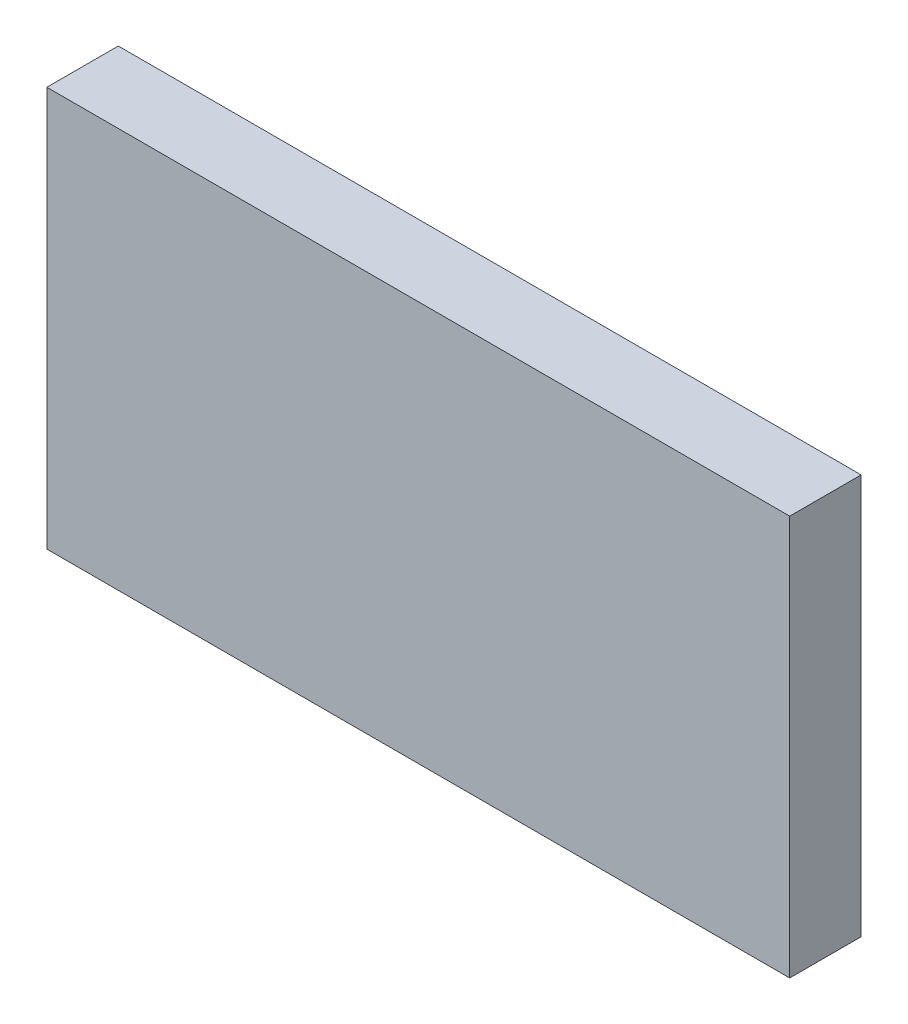
from build123d import *

# Parameters (mm, degrees)
SKETCH1_W           = 26
SKETCH1_H           = 2.5
BOSS_EXTRUDE1_DEPTH = 14


with BuildPart() as part:
    # Sketch1 → Boss-Extrude1 (new body)
    with BuildSketch(Plane(origin=(0, 0, 0), x_dir=(1, 0, 0), z_dir=(0, 1, 0))):
        with Locations((13, 1.25)):
            Rectangle(SKETCH1_W, SKETCH1_H)
    extrude(amount=BOSS_EXTRUDE1_DEPTH)


solid = part.part
